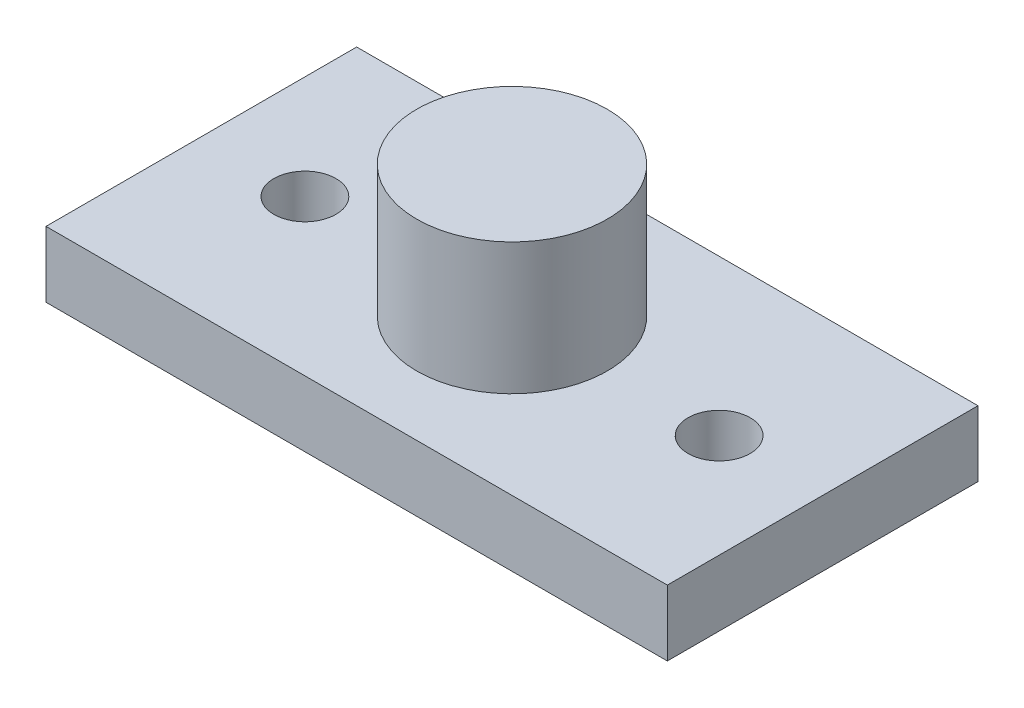
from build123d import *

# Parameters (mm, degrees)
SKETCH1_R           = 4.6
BOSS_EXTRUDE1_DEPTH = 9.525
SKETCH1_3_W         = 30
SKETCH1_3_H         = 15
SKETCH1_3_R         = 1.5
BOSS_EXTRUDE2_DEPTH = 3.175


with BuildPart() as part:
    # Sketch1 → Boss-Extrude1 (new body)
    with BuildSketch(Plane(origin=(0, 0, 0), x_dir=(1, 0, 0), z_dir=(0, 1, 0))):
        with Locations((15, 7.5)):
            Circle(SKETCH1_R)
    extrude(amount=BOSS_EXTRUDE1_DEPTH)

    # Sketch1<3> → Boss-Extrude2 (add)
    with BuildSketch(Plane(origin=(0, 0, 0), x_dir=(1, 0, 0), z_dir=(0, 1, 0))):
        with Locations((15, 7.5)):
            Rectangle(SKETCH1_3_W, SKETCH1_3_H)
        with Locations((5, 7.5)):
            Circle(SKETCH1_3_R, mode=Mode.SUBTRACT)
        with BuildLine():
            ThreePointArc((10.4, 7.5), (15, 12.1), (19.6, 7.5))
            ThreePointArc((19.6, 7.5), (15, 2.9), (10.4, 7.5))
        make_face(mode=Mode.SUBTRACT)
        with BuildLine():
            ThreePointArc((26.5, 7.5), (25, 6), (23.5, 7.5))
            ThreePointArc((23.5, 7.5), (25, 9), (26.5, 7.5))
        make_face(mode=Mode.SUBTRACT)
    extrude(amount=BOSS_EXTRUDE2_DEPTH)


solid = part.part
